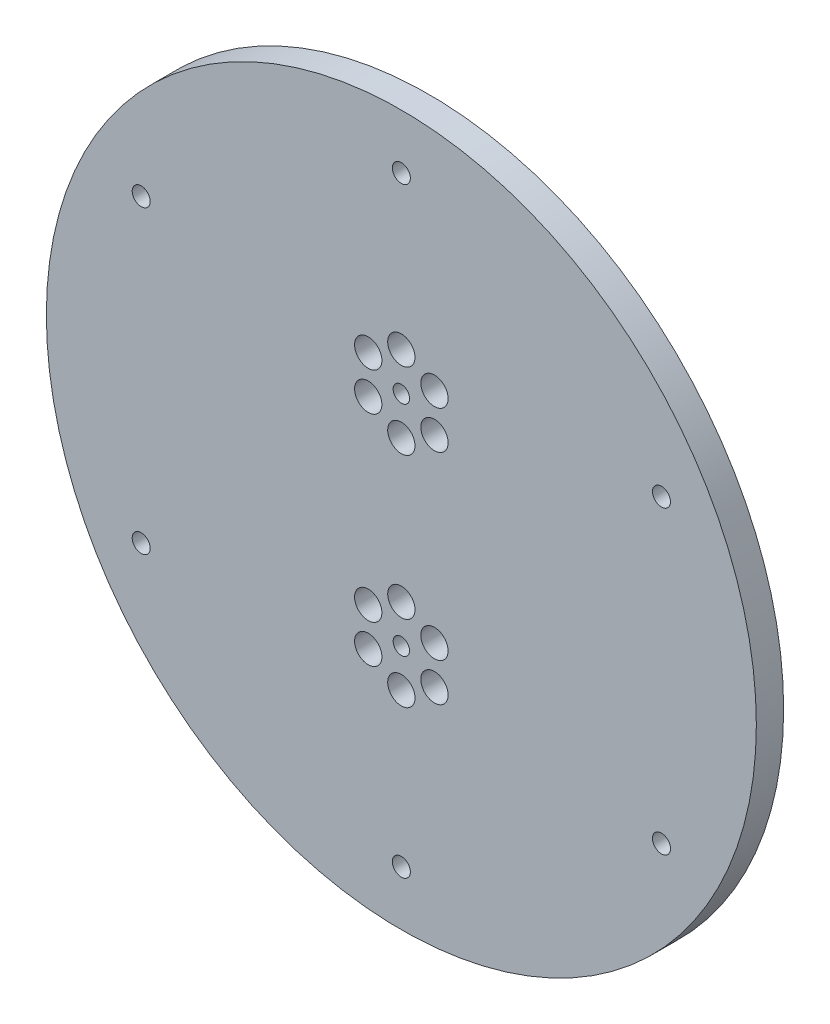
from build123d import *

# Parameters (mm, degrees)
SKETCH1_R           = 65
SKETCH1_R_2         = 1.65
SKETCH1_R_3         = 2.5
SKETCH1_R_4         = 1.5
BOSS_EXTRUDE1_DEPTH = 5


with BuildPart() as part:
    # Sketch1 → Boss-Extrude1 (new body)
    with BuildSketch(Plane.XY):
        Circle(SKETCH1_R)
        with Locations((0, 55)):
            Circle(SKETCH1_R_2, mode=Mode.SUBTRACT)
        with Locations((47.631397208, 27.5)):
            Circle(SKETCH1_R_2, mode=Mode.SUBTRACT)
        with Locations((47.631397208, -27.5)):
            Circle(SKETCH1_R_2, mode=Mode.SUBTRACT)
        with Locations((0, -55)):
            Circle(SKETCH1_R_2, mode=Mode.SUBTRACT)
        with Locations((-47.631397208, -27.5)):
            Circle(SKETCH1_R_2, mode=Mode.SUBTRACT)
        with Locations((-47.631397208, 27.5)):
            Circle(SKETCH1_R_2, mode=Mode.SUBTRACT)
        with Locations((0, 27)):
            Circle(SKETCH1_R_3, mode=Mode.SUBTRACT)
        with Locations((6.062177826, 23.5)):
            Circle(SKETCH1_R_3, mode=Mode.SUBTRACT)
        with Locations((6.062177826, 16.5)):
            Circle(SKETCH1_R_3, mode=Mode.SUBTRACT)
        with Locations((0, 13)):
            Circle(SKETCH1_R_3, mode=Mode.SUBTRACT)
        with Locations((-6.062177826, 16.5)):
            Circle(SKETCH1_R_3, mode=Mode.SUBTRACT)
        with Locations((-6.062177826, 23.5)):
            Circle(SKETCH1_R_3, mode=Mode.SUBTRACT)
        with Locations((0, 20)):
            Circle(SKETCH1_R_4, mode=Mode.SUBTRACT)
        with Locations(Location((6.062177826, -16.5, 0), (0, 0, 180))):
            Circle(SKETCH1_R_3, mode=Mode.SUBTRACT)
        with Locations(Location((0, -13, 0), (0, 0, 180))):
            Circle(SKETCH1_R_3, mode=Mode.SUBTRACT)
        with Locations(Location((-6.062177826, -16.5, 0), (0, 0, 180))):
            Circle(SKETCH1_R_3, mode=Mode.SUBTRACT)
        with Locations(Location((0, -20, 0), (0, 0, 180))):
            Circle(SKETCH1_R_4, mode=Mode.SUBTRACT)
        with Locations(Location((-6.062177826, -23.5, 0), (0, 0, 180))):
            Circle(SKETCH1_R_3, mode=Mode.SUBTRACT)
        with Locations(Location((0, -27, 0), (0, 0, 180))):
            Circle(SKETCH1_R_3, mode=Mode.SUBTRACT)
        with Locations(Location((6.062177826, -23.5, 0), (0, 0, 180))):
            Circle(SKETCH1_R_3, mode=Mode.SUBTRACT)
    extrude(amount=BOSS_EXTRUDE1_DEPTH)


solid = part.part
